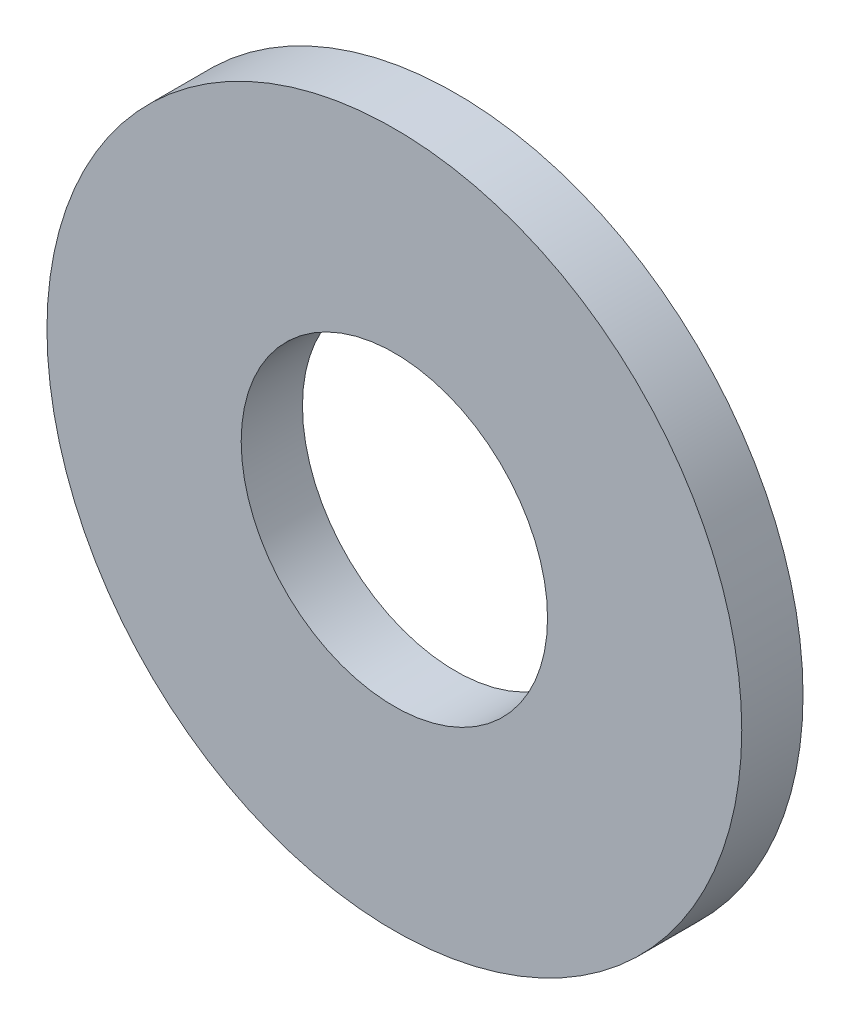
from build123d import *

# Parameters (mm, degrees)
SKETCH1_R           = 7.2009
BOSS_EXTRUDE1_DEPTH = 1.27
SKETCH2_R           = 3.175
CUT_EXTRUDE1_DEPTH  = 11.262495877


with BuildPart() as part:
    # Sketch1 → Boss-Extrude1 (new body)
    with BuildSketch(Plane.XY):
        Circle(SKETCH1_R)
    extrude(amount=BOSS_EXTRUDE1_DEPTH)

    # Sketch2 → Cut-Extrude1 (cut, through all)
    with BuildSketch(Plane.XY.offset(1.27)):
        Circle(SKETCH2_R)
    extrude(amount=-CUT_EXTRUDE1_DEPTH, mode=Mode.SUBTRACT)


solid = part.part
